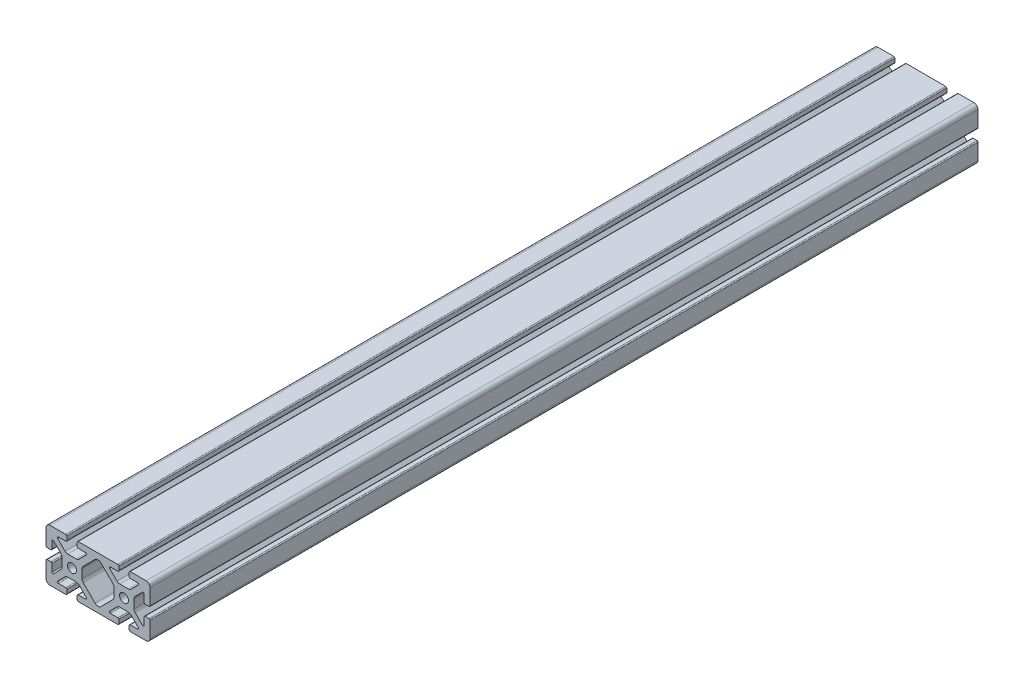
from build123d import *

# Parameters (mm, degrees)
SKETCH1_R      = 3.4036
EXTRUDE1_DEPTH = 317.5


with BuildPart() as part:
    # Sketch1 → Extrude1 (new, symmetric)
    with BuildSketch(Plane.XY):
        with BuildLine():
            Line((-19.939, 16.891), (-19.939, 4.7625))
            ThreePointArc((-19.939, 4.7625), (-19.715815367, 4.223684633), (-19.177, 4.0005))
            Line((-19.177, 4.0005), (-16.2052, 4.0005))
            ThreePointArc((-16.2052, 4.0005), (-15.666384633, 4.223684633), (-15.4432, 4.7625))
            Line((-15.4432, 4.7625), (-15.4432, 10.424558599))
            ThreePointArc((-15.4432, 10.424558599), (-14.972804775, 11.128554802), (-14.142384633, 10.963373966))
            Line((-14.142384633, 10.963373966), (-8.574059555, 5.395048889))
            ThreePointArc((-8.574059555, 5.395048889), (-7.924348265, 4.422687227), (-7.6962, 3.275708444))
            Line((-7.6962, 3.275708444), (-7.6962, -3.275708444))
            ThreePointArc((-7.6962, -3.275708444), (-7.924348265, -4.422687227), (-8.574059555, -5.395048889))
            Line((-8.574059555, -5.395048889), (-14.142384633, -10.963373966))
            ThreePointArc((-14.142384633, -10.963373966), (-14.972804775, -11.128554802), (-15.4432, -10.424558599))
            Line((-15.4432, -10.424558599), (-15.4432, -4.7625))
            ThreePointArc((-15.4432, -4.7625), (-15.666384633, -4.223684633), (-16.2052, -4.0005))
            Line((-16.2052, -4.0005), (-19.177, -4.0005))
            ThreePointArc((-19.177, -4.0005), (-19.715815367, -4.223684633), (-19.939, -4.7625))
            Line((-19.939, -4.7625), (-19.939, -16.891))
            ThreePointArc((-19.939, -16.891), (-19.046261469, -19.046261469), (-16.891, -19.939))
            Line((-16.891, -19.939), (-4.7625, -19.939))
            ThreePointArc((-4.7625, -19.939), (-4.223684633, -19.715815367), (-4.0005, -19.177))
            Line((-4.0005, -19.177), (-4.0005, -16.2052))
            ThreePointArc((-4.0005, -16.2052), (-4.223684633, -15.666384633), (-4.7625, -15.4432))
            Line((-4.7625, -15.4432), (-10.424558599, -15.4432))
            ThreePointArc((-10.424558599, -15.4432), (-11.128554802, -14.972804775), (-10.963373966, -14.142384633))
            Line((-10.963373966, -14.142384633), (-5.395048889, -8.574059555))
            ThreePointArc((-5.395048889, -8.574059555), (-4.422687227, -7.924348265), (-3.275708444, -7.6962))
            Line((-3.275708444, -7.6962), (3.275708444, -7.6962))
            ThreePointArc((3.275708444, -7.6962), (4.422687227, -7.924348265), (5.395048889, -8.574059555))
            Line((5.395048889, -8.574059555), (10.963373966, -14.142384633))
            ThreePointArc((10.963373966, -14.142384633), (11.128554802, -14.972804775), (10.424558599, -15.4432))
            Line((10.424558599, -15.4432), (4.7625, -15.4432))
            ThreePointArc((4.7625, -15.4432), (4.223684633, -15.666384633), (4.0005, -16.2052))
            Line((4.0005, -16.2052), (4.0005, -19.177))
            ThreePointArc((4.0005, -19.177), (4.223684633, -19.715815367), (4.7625, -19.939))
            Line((4.7625, -19.939), (19.939, -19.939))
            Line((19.939, -19.939), (35.1155, -19.939))
            ThreePointArc((35.1155, -19.939), (35.654315367, -19.715815367), (35.8775, -19.177))
            Line((35.8775, -19.177), (35.8775, -16.2052))
            ThreePointArc((35.8775, -16.2052), (35.654315367, -15.666384633), (35.1155, -15.4432))
            Line((35.1155, -15.4432), (29.453441401, -15.4432))
            ThreePointArc((29.453441401, -15.4432), (28.749445198, -14.972804775), (28.914626034, -14.142384633))
            Line((28.914626034, -14.142384633), (34.482951111, -8.574059555))
            ThreePointArc((34.482951111, -8.574059555), (35.455312773, -7.924348265), (36.602291556, -7.6962))
            Line((36.602291556, -7.6962), (43.153708444, -7.6962))
            ThreePointArc((43.153708444, -7.6962), (44.300687227, -7.924348265), (45.273048889, -8.574059555))
            Line((45.273048889, -8.574059555), (50.841373966, -14.142384633))
            ThreePointArc((50.841373966, -14.142384633), (51.006554802, -14.972804775), (50.302558599, -15.4432))
            Line((50.302558599, -15.4432), (44.6405, -15.4432))
            ThreePointArc((44.6405, -15.4432), (44.101684633, -15.666384633), (43.8785, -16.2052))
            Line((43.8785, -16.2052), (43.8785, -19.177))
            ThreePointArc((43.8785, -19.177), (44.101684633, -19.715815367), (44.6405, -19.939))
            Line((44.6405, -19.939), (56.769, -19.939))
            ThreePointArc((56.769, -19.939), (58.924261469, -19.046261469), (59.817, -16.891))
            Line((59.817, -16.891), (59.817, -4.7625))
            ThreePointArc((59.817, -4.7625), (59.593815367, -4.223684633), (59.055, -4.0005))
            Line((59.055, -4.0005), (56.0832, -4.0005))
            ThreePointArc((56.0832, -4.0005), (55.544384633, -4.223684633), (55.3212, -4.7625))
            Line((55.3212, -4.7625), (55.3212, -10.424558599))
            ThreePointArc((55.3212, -10.424558599), (54.850804775, -11.128554802), (54.020384633, -10.963373966))
            Line((54.020384633, -10.963373966), (48.452059555, -5.395048889))
            ThreePointArc((48.452059555, -5.395048889), (47.802348265, -4.422687227), (47.5742, -3.275708444))
            Line((47.5742, -3.275708444), (47.5742, 3.275708444))
            ThreePointArc((47.5742, 3.275708444), (47.802348265, 4.422687227), (48.452059555, 5.395048889))
            Line((48.452059555, 5.395048889), (54.020384633, 10.963373966))
            ThreePointArc((54.020384633, 10.963373966), (54.850804775, 11.128554802), (55.3212, 10.424558599))
            Line((55.3212, 10.424558599), (55.3212, 4.7625))
            ThreePointArc((55.3212, 4.7625), (55.544384633, 4.223684633), (56.0832, 4.0005))
            Line((56.0832, 4.0005), (59.055, 4.0005))
            ThreePointArc((59.055, 4.0005), (59.593815367, 4.223684633), (59.817, 4.7625))
            Line((59.817, 4.7625), (59.817, 16.891))
            ThreePointArc((59.817, 16.891), (58.924261469, 19.046261469), (56.769, 19.939))
            Line((56.769, 19.939), (44.6405, 19.939))
            ThreePointArc((44.6405, 19.939), (44.101684633, 19.715815367), (43.8785, 19.177))
            Line((43.8785, 19.177), (43.8785, 16.2052))
            ThreePointArc((43.8785, 16.2052), (44.101684633, 15.666384633), (44.6405, 15.4432))
            Line((44.6405, 15.4432), (50.302558599, 15.4432))
            ThreePointArc((50.302558599, 15.4432), (51.006554802, 14.972804775), (50.841373966, 14.142384633))
            Line((50.841373966, 14.142384633), (45.273048889, 8.574059555))
            ThreePointArc((45.273048889, 8.574059555), (44.300687227, 7.924348265), (43.153708444, 7.6962))
            Line((43.153708444, 7.6962), (36.602291556, 7.6962))
            ThreePointArc((36.602291556, 7.6962), (35.455312773, 7.924348265), (34.482951111, 8.574059555))
            Line((34.482951111, 8.574059555), (28.914626034, 14.142384633))
            ThreePointArc((28.914626034, 14.142384633), (28.749445198, 14.972804775), (29.453441401, 15.4432))
            Line((29.453441401, 15.4432), (35.1155, 15.4432))
            ThreePointArc((35.1155, 15.4432), (35.654315367, 15.666384633), (35.8775, 16.2052))
            Line((35.8775, 16.2052), (35.8775, 19.177))
            ThreePointArc((35.8775, 19.177), (35.654315367, 19.715815367), (35.1155, 19.939))
            Line((35.1155, 19.939), (4.7625, 19.939))
            ThreePointArc((4.7625, 19.939), (4.223684633, 19.715815367), (4.0005, 19.177))
            Line((4.0005, 19.177), (4.0005, 16.2052))
            ThreePointArc((4.0005, 16.2052), (4.223684633, 15.666384633), (4.7625, 15.4432))
            Line((4.7625, 15.4432), (10.424558599, 15.4432))
            ThreePointArc((10.424558599, 15.4432), (11.128554802, 14.972804775), (10.963373966, 14.142384633))
            Line((10.963373966, 14.142384633), (5.395048889, 8.574059555))
            ThreePointArc((5.395048889, 8.574059555), (4.422687227, 7.924348265), (3.275708444, 7.6962))
            Line((3.275708444, 7.6962), (-3.275708444, 7.6962))
            ThreePointArc((-3.275708444, 7.6962), (-4.422687227, 7.924348265), (-5.395048889, 8.574059555))
            Line((-5.395048889, 8.574059555), (-10.963373966, 14.142384633))
            ThreePointArc((-10.963373966, 14.142384633), (-11.128554802, 14.972804775), (-10.424558599, 15.4432))
            Line((-10.424558599, 15.4432), (-4.7625, 15.4432))
            ThreePointArc((-4.7625, 15.4432), (-4.223684633, 15.666384633), (-4.0005, 16.2052))
            Line((-4.0005, 16.2052), (-4.0005, 19.177))
            ThreePointArc((-4.0005, 19.177), (-4.223684633, 19.715815367), (-4.7625, 19.939))
            Line((-4.7625, 19.939), (-16.891, 19.939))
            ThreePointArc((-16.891, 19.939), (-19.046261469, 19.046261469), (-19.939, 16.891))
        make_face()
        with Locations(Location((0, 0, 0), (0, 0, 180))):
            Circle(SKETCH1_R, mode=Mode.SUBTRACT)
        with Locations(Location((39.878, 0, 0), (0, 0, 180))):
            Circle(SKETCH1_R, mode=Mode.SUBTRACT)
        with BuildLine():
            Line((7.6962, 3.275708444), (7.6962, -3.275708444))
            ThreePointArc((7.6962, -3.275708444), (7.924348265, -4.422687227), (8.574059555, -5.395048889))
            Line((8.574059555, -5.395048889), (17.6911, -14.512089333))
            ThreePointArc((17.6911, -14.512089333), (19.939, -15.4432), (22.1869, -14.512089333))
            Line((22.1869, -14.512089333), (31.303940445, -5.395048889))
            ThreePointArc((31.303940445, -5.395048889), (31.953651735, -4.422687227), (32.1818, -3.275708444))
            Line((32.1818, -3.275708444), (32.1818, 3.275708444))
            ThreePointArc((32.1818, 3.275708444), (31.953651735, 4.422687227), (31.303940445, 5.395048889))
            Line((31.303940445, 5.395048889), (22.1869, 14.512089333))
            ThreePointArc((22.1869, 14.512089333), (19.939, 15.4432), (17.6911, 14.512089333))
            Line((17.6911, 14.512089333), (8.574059555, 5.395048889))
            ThreePointArc((8.574059555, 5.395048889), (7.924348265, 4.422687227), (7.6962, 3.275708444))
        make_face(mode=Mode.SUBTRACT)
    extrude(amount=EXTRUDE1_DEPTH, both=True)


solid = part.part
